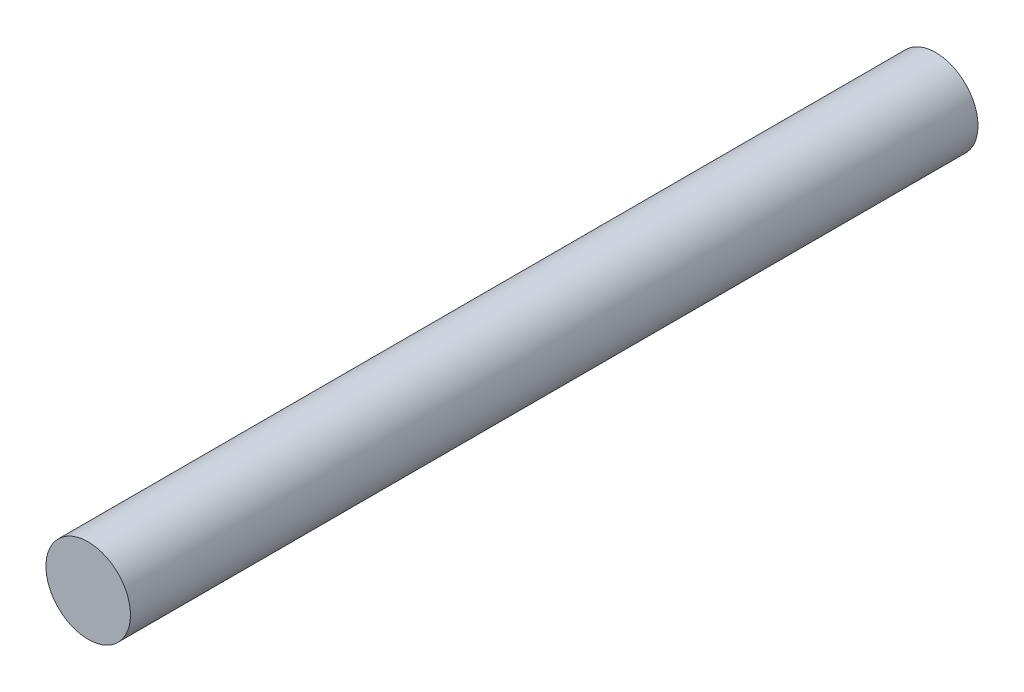
from build123d import *

# Parameters (mm, degrees)
SKETCH1_R           = 99.7465
BOSS_EXTRUDE1_DEPTH = 2000


with BuildPart() as part:
    # Sketch1 → Boss-Extrude1 (new body)
    with BuildSketch(Plane.XY):
        Circle(SKETCH1_R)
    extrude(amount=BOSS_EXTRUDE1_DEPTH)


solid = part.part
